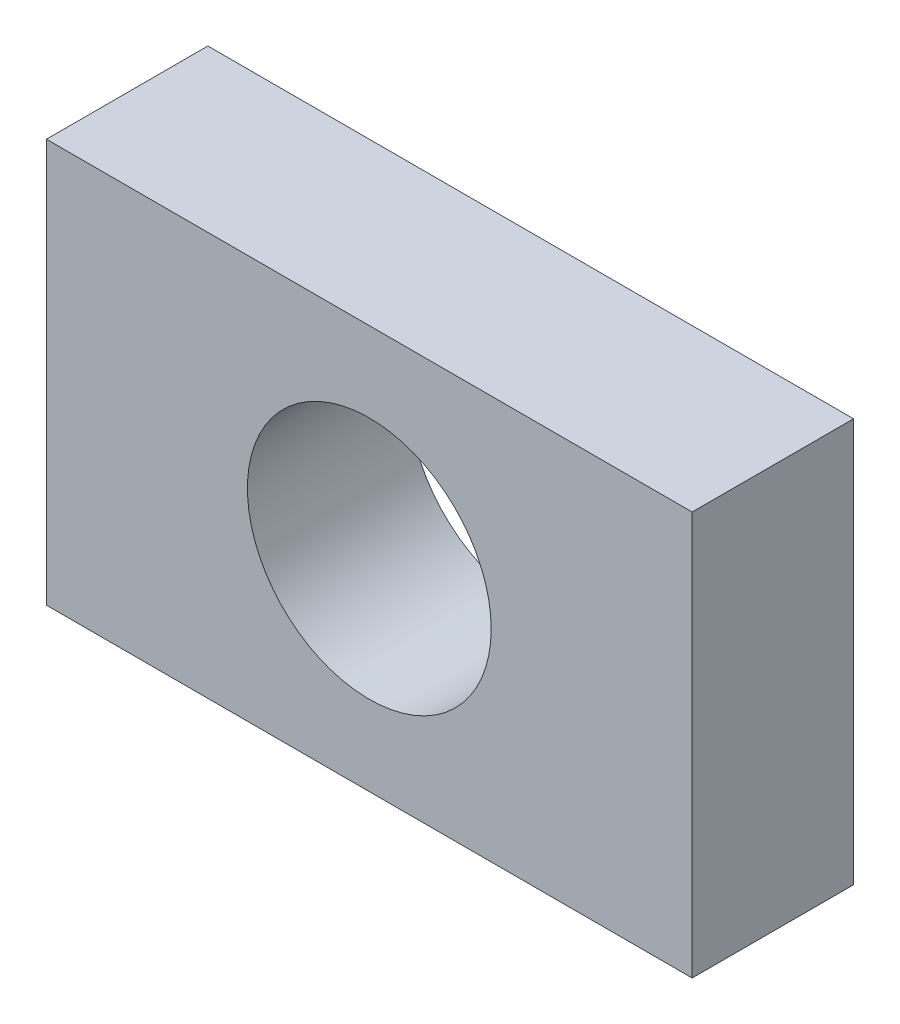
from build123d import *

# Parameters (mm, degrees)
BEARING_BLOCK_PROFILE_W     = 80
BEARING_BLOCK_PROFILE_H     = 50
BEARING_BLOCK_PROFILE_R     = 15.1
BEARING_BLOCK_EXTRUDE_DEPTH = 10


with BuildPart() as part:
    # Bearing_Block_Profile → Bearing_Block_Extrude (new, symmetric)
    with BuildSketch(Plane.XY):
        Rectangle(BEARING_BLOCK_PROFILE_W, BEARING_BLOCK_PROFILE_H)
        Circle(BEARING_BLOCK_PROFILE_R, mode=Mode.SUBTRACT)
    extrude(amount=BEARING_BLOCK_EXTRUDE_DEPTH, both=True)


solid = part.part
